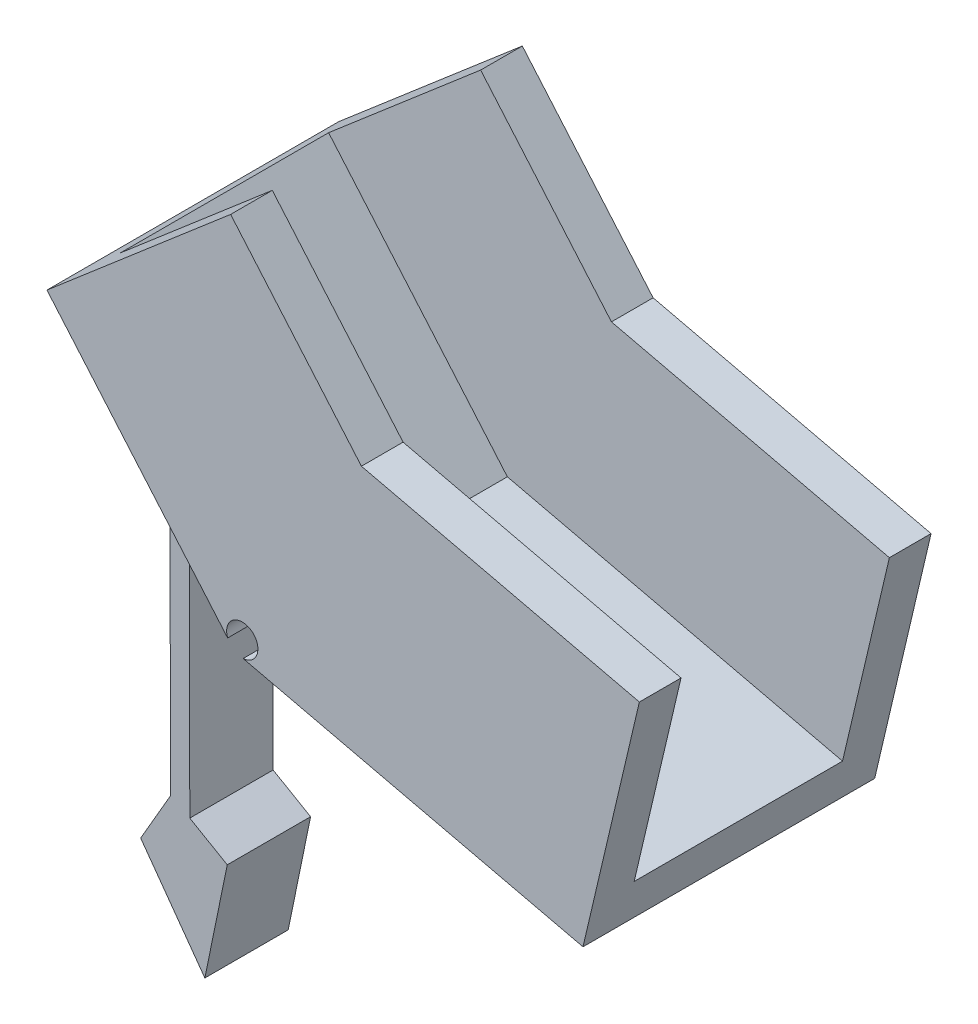
from build123d import *

# Parameters (mm, degrees)
EXTRUDE_THIN1_DEPTH = 10
BOSS_EXTRUDE1_DEPTH = 2
BOSS_EXTRUDE2_START = -10
BOSS_EXTRUDE2_DEPTH = 2
SKETCH3_R           = 0.75
CUT_EXTRUDE1_DEPTH  = 56.66160031
BOSS_EXTRUDE3_START = -8
BOSS_EXTRUDE3_DEPTH = 4


with BuildPart() as part:
    # Sketch1 → Extrude-Thin1 (new body)
    with BuildSketch(Plane(origin=(-21.326839193, -3.611933395, 0), x_dir=(1, 0, 0), z_dir=(0, 0, 1))):
        Polygon((40.837274636, 20.62649088), (49.842183721, 10.115955591), (66.565347849, 6.191262572), (67.022304548, 8.13836056), (50.935628307, 11.913678763), (42.35608206, 21.927730293), align=None)
    extrude(amount=EXTRUDE_THIN1_DEPTH)

    # Sketch2 → Boss-Extrude1 (add)
    with BuildSketch(Plane.XY.offset(10)):
        Polygon((19.510435444, 17.014557485), (28.32605504, 24.567346264), (34.604051118, 17.239665473), (47.944334875, 14.108887223), (45.238508656, 2.579329178), (28.515344528, 6.504022197), align=None)
    extrude(amount=BOSS_EXTRUDE1_DEPTH)

    # Sketch2<2> → Boss-Extrude2 (add)
    with BuildSketch(Plane.XY.offset(10).offset(BOSS_EXTRUDE2_START)):
        Polygon((21.029242867, 18.315796898), (19.510435444, 17.014557485), (28.515344528, 6.504022197), (45.238508656, 2.579329178), (45.695465355, 4.526427166), (29.608789115, 8.301745368), align=None)
        Polygon((28.32605504, 24.567346264), (21.029242867, 18.315796898), (29.608789115, 8.301745368), (45.695465355, 4.526427166), (47.944334875, 14.108887223), (34.604051118, 17.239665473), align=None)
    extrude(amount=-BOSS_EXTRUDE2_DEPTH)

    # Sketch3 → Cut-Extrude1 (cut, through all)
    with BuildSketch(Plane.XY.offset(12)):
        with Locations((28.885341988, 7.156403894)):
            Circle(SKETCH3_R)
    extrude(amount=-CUT_EXTRUDE1_DEPTH, mode=Mode.SUBTRACT)

    # Sketch4 → Boss-Extrude3 (add)
    with BuildSketch(Plane.XY.offset(12).offset(BOSS_EXTRUDE3_START)):
        Polygon((26.37923513, 8.997290369), (25.447689261, 10.084591266), (21.423335505, 6.636723131), (21.434748512, -5.051368103), (20.008730224, -7.513493145), (23.089867331, -11.79022436), (24.164473573, -6.548039274), (22.365676805, -5.506208724), (22.354881373, 5.549422234), align=None)
    extrude(amount=BOSS_EXTRUDE3_DEPTH)


solid = part.part
